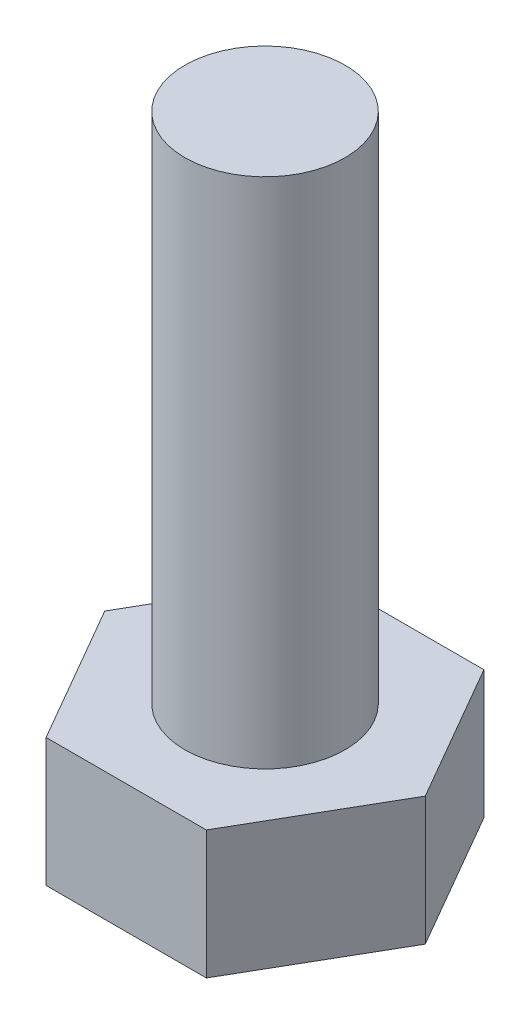
from build123d import *

# Parameters (mm, degrees)
EXTRUDE_1_DEPTH = 2
SKETCH_2_R      = 1.25
EXTRUDE_2_DEPTH = 8


with BuildPart() as part:
    # 草图1 → 凸台-拉伸1 (new body)
    with BuildSketch(Plane(origin=(0, 0, 0), x_dir=(1, 0, 0), z_dir=(0, 1, 0))):
        Polygon((1.25, 2.165063509), (-1.25, 2.165063509), (-2.5, 0), (-1.25, -2.165063509), (1.25, -2.165063509), (2.5, 0), align=None)
    extrude(amount=EXTRUDE_1_DEPTH)

    # 草图2 → 凸台-拉伸2 (add)
    with BuildSketch(Plane(origin=(0, 2, 0), x_dir=(1, 0, 0), z_dir=(0, 1, 0))):
        with Locations(Location((0, 0, 0), (0, 0, 270))):
            Circle(SKETCH_2_R)
    extrude(amount=EXTRUDE_2_DEPTH)


solid = part.part
